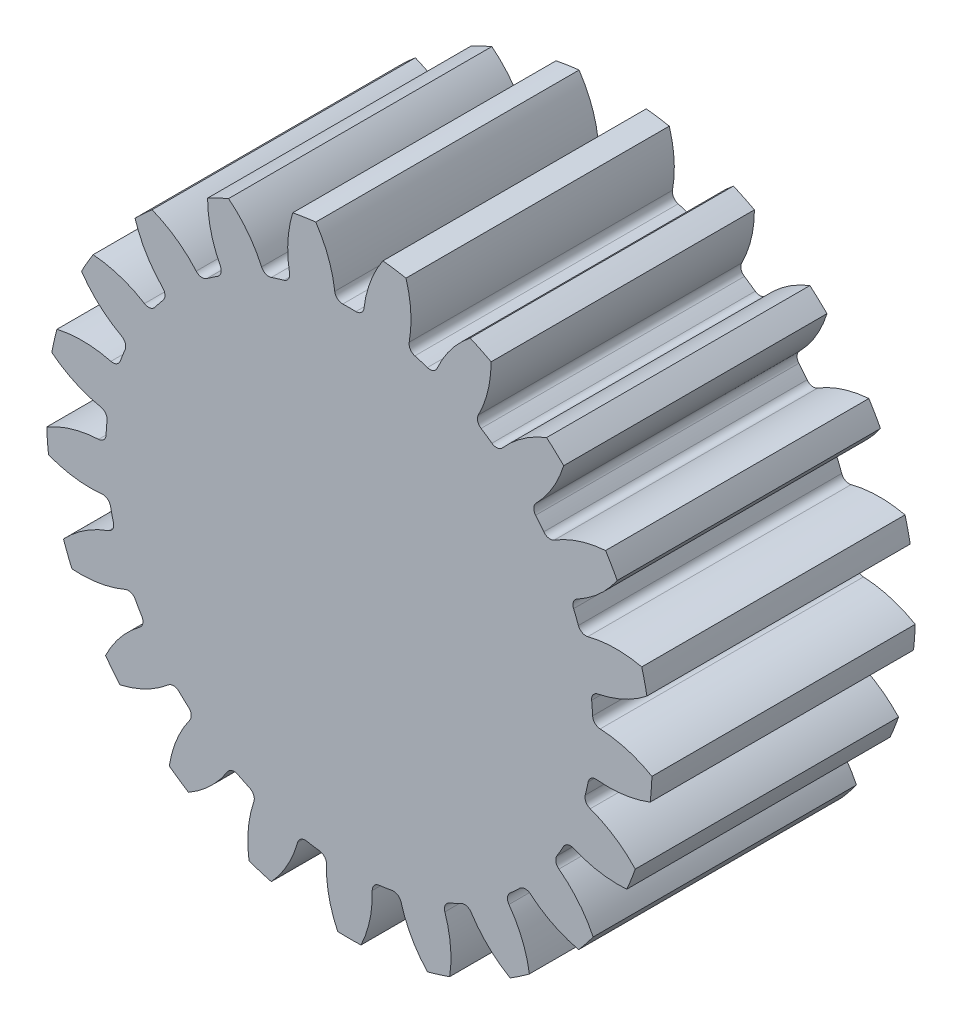
from build123d import *

# Parameters (mm, degrees)
SKETCH2_R                = 23
BOSS_EXTRUDE1_DEPTH      = 10
CUT_EXTRUDE1_DEPTH       = 35.029399054
FILLET1_R                = 0.6
CIRPATTERN1_COUNT        = 21
FILLET1_OF_CIRPATTERN1_R = 0.6
CUT_EXTRUDE3_DEPTH       = 10


with BuildPart() as part:
    # Sketch2 → Boss-Extrude1 (new, symmetric)
    with BuildSketch(Plane.XY):
        Circle(SKETCH2_R)
    extrude(amount=BOSS_EXTRUDE1_DEPTH, both=True)

    # Sketch3 → Cut-Extrude1 (cut, symmetric)
    with BuildSketch(Plane.XY):
        with BuildLine():
            ThreePointArc((1.060061473, 18.469603939), (0, 18.5), (-1.060061473, 18.469603939))
            ThreePointArc((-1.060061473, 18.469603939), (-1.507377522, 20.765193426), (-2.55127633, 22.858061796))
            ThreePointArc((-2.55127633, 22.858061796), (0, 23), (2.55127633, 22.858061796))
            ThreePointArc((2.55127633, 22.858061796), (1.507377522, 20.765193426), (1.060061473, 18.469603939))
        make_face()
    cut_extrude1 = extrude(amount=CUT_EXTRUDE1_DEPTH, both=True, mode=Mode.SUBTRACT)

    # Fillet1
    fillet1_edges = [part.edges().sort_by_distance(p)[0] for p in [
        (1.060061473, 18.469603939, 0),
        (-1.060061473, 18.469603939, 0),
    ]]
    fillet(fillet1_edges, radius=FILLET1_R)

    # CirPattern1: Cut-Extrude1 ×21 about axis
    cirpattern1_axis = Axis((0, 0, -11), (0, 0, 1))
    for i in range(1, CIRPATTERN1_COUNT):
        add(cut_extrude1.rotate(cirpattern1_axis, i * 360 / CIRPATTERN1_COUNT), mode=Mode.SUBTRACT)

    # Fillet1 of CirPattern1
    fillet1_of_cirpattern1_edges = [part.edges().sort_by_distance(p)[0] for p in [
        (-4.431045414, 17.961509862, 0),
        (-6.456977247, 17.336592653, 0),
        (-9.528434471, 15.857456812, 0),
        (-11.280162256, 14.66314903, 0),
        (-13.77918031, 12.344399134, 0),
        (-15.101055346, 10.686820267, 0),
        (-16.80558551, 7.73448742, 0),
        (-17.580153399, 5.760920625, 0),
        (-18.338740688, 2.437332557, 0),
        (-18.497177674, 0.323137904, 0),
        (-18.242418276, -3.076389999, 0),
        (-17.770646538, -5.143357037, 0),
        (-16.525176946, -8.316761804, 0),
        (-15.465115473, -10.152842135, 0),
        (-13.339601124, -12.818152825, 0),
        (-11.78544103, -14.260202654, 0),
        (-8.968743203, -16.180594716, 0),
        (-7.058578432, -17.100481588, 0),
        (-3.800973089, -18.105319759, 0),
        (-1.704530164, -18.421307688, 0),
        (1.704530164, -18.421307688, 0),
        (3.800973089, -18.105319759, 0),
        (7.058578432, -17.100481588, 0),
        (8.968743203, -16.180594716, 0),
        (11.78544103, -14.260202654, 0),
        (13.339601124, -12.818152825, 0),
        (15.465115473, -10.152842135, 0),
        (16.525176946, -8.316761804, 0),
        (17.770646538, -5.143357037, 0),
        (18.242418276, -3.076389999, 0),
        (18.497177674, 0.323137904, 0),
        (18.338740688, 2.437332557, 0),
        (17.580153399, 5.760920625, 0),
        (16.80558551, 7.73448742, 0),
        (15.101055346, 10.686820267, 0),
        (13.77918031, 12.344399134, 0),
        (11.280162256, 14.66314903, 0),
        (9.528434471, 15.857456812, 0),
        (6.456977247, 17.336592653, 0),
        (4.431045414, 17.961509862, 0),
    ]]
    fillet(fillet1_of_cirpattern1_edges, radius=FILLET1_OF_CIRPATTERN1_R)

    # Sketch4 → Cut-Extrude3 (cut)
    with BuildSketch(Plane(origin=(0, 0, -10), x_dir=(-1, 0, 0), z_dir=(0, 0, -1))):
        with BuildLine():
            Line((-1.5, 2), (1.5, 2))
            ThreePointArc((1.5, 2), (0, -2.5), (-1.5, 2))
        make_face()
    extrude(amount=-CUT_EXTRUDE3_DEPTH, mode=Mode.SUBTRACT)


solid = part.part
